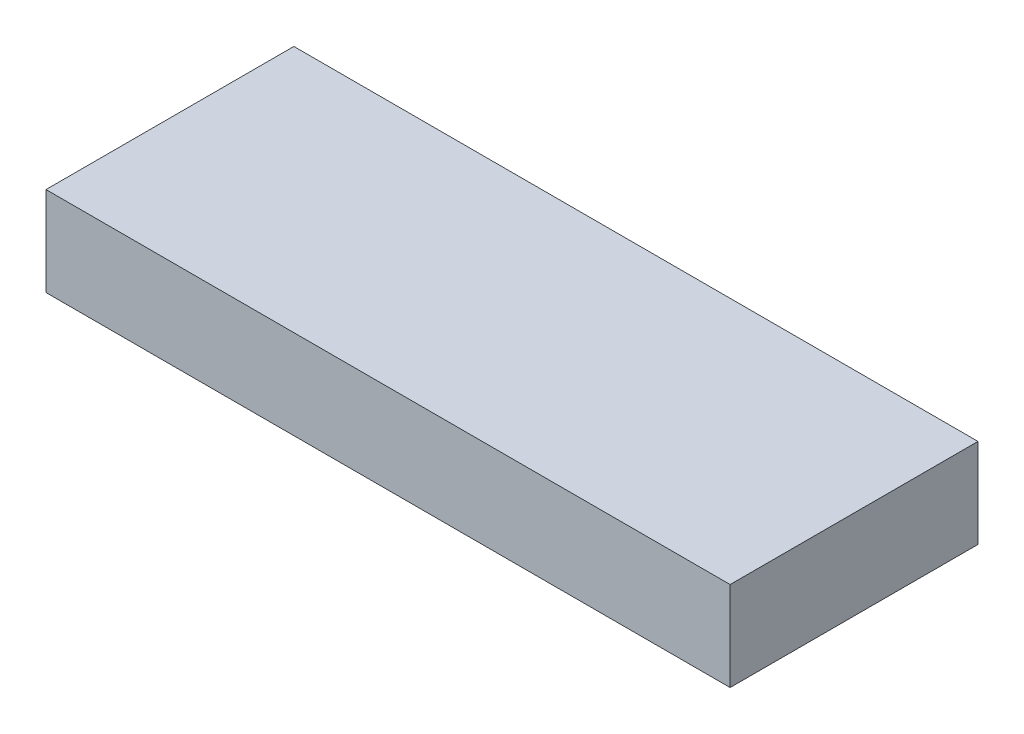
from build123d import *

# Parameters (mm, degrees)
SKETCH1_W           = 34.5
SKETCH1_H           = 12.5
BOSS_EXTRUDE1_DEPTH = 4.5


with BuildPart() as part:
    # Sketch1 → Boss-Extrude1 (new body)
    with BuildSketch(Plane(origin=(0, 0, 0), x_dir=(1, 0, 0), z_dir=(0, 1, 0))):
        Rectangle(SKETCH1_W, SKETCH1_H)
    extrude(amount=BOSS_EXTRUDE1_DEPTH)


solid = part.part
